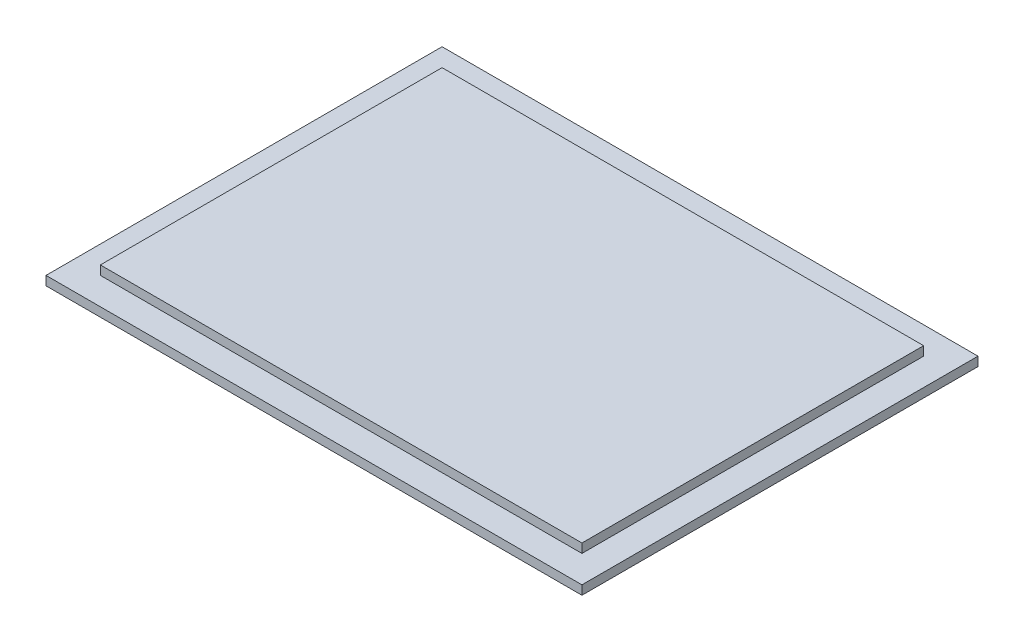
from build123d import *

# Parameters (mm, degrees)
SKETCH1_W           = 53.16
SKETCH1_H           = 37.72
BOSS_EXTRUDE1_DEPTH = 1
SKETCH2_W           = 59.16
SKETCH2_H           = 43.72
SKETCH2_W_2         = 53.16
SKETCH2_H_2         = 37.72
BOSS_EXTRUDE2_DEPTH = 1


with BuildPart() as part:
    # Sketch1 → Boss-Extrude1 (new body)
    with BuildSketch(Plane(origin=(0, 0, 0), x_dir=(1, 0, 0), z_dir=(0, 1, 0))):
        Rectangle(SKETCH1_W, SKETCH1_H)
    extrude(amount=BOSS_EXTRUDE1_DEPTH)


with BuildPart() as body_2:
    # Sketch2 → Boss-Extrude2 (new body)
    with BuildSketch(Plane.XZ):
        Rectangle(SKETCH2_W, SKETCH2_H)
        Rectangle(SKETCH2_W_2, SKETCH2_H_2, mode=Mode.SUBTRACT)
    extrude(amount=BOSS_EXTRUDE2_DEPTH)


solid = Compound([part.part, body_2.part])
